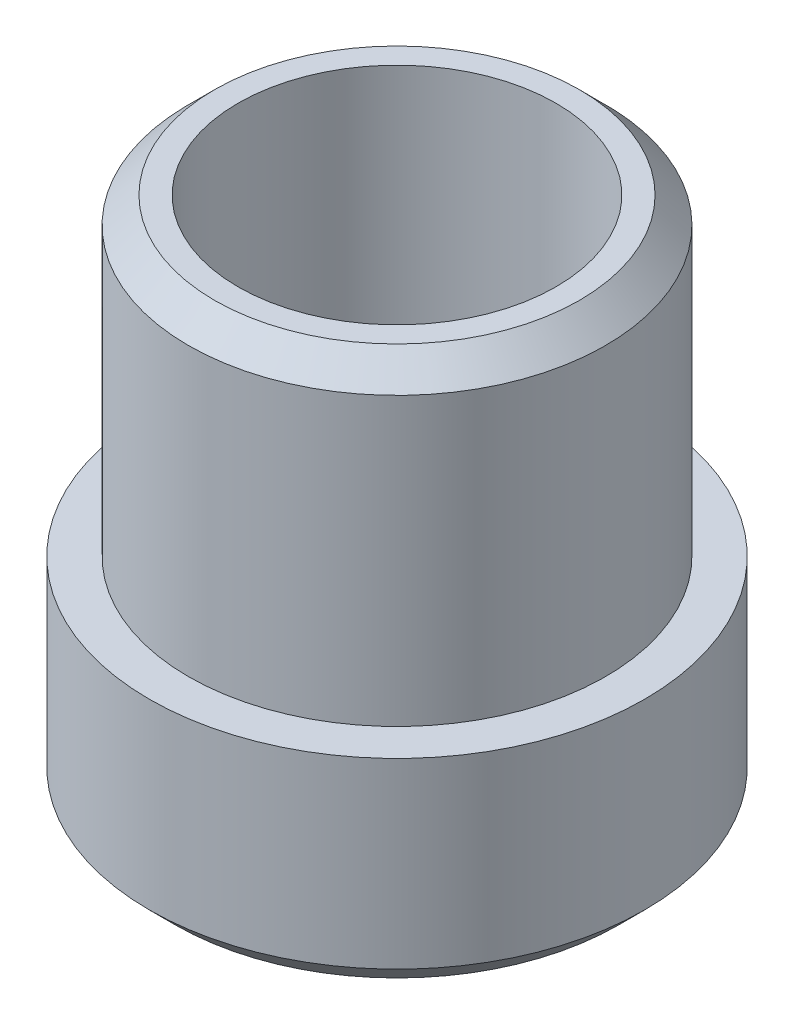
from build123d import *

# Parameters (mm, degrees)
SKETCH1_R           = 4.75
BOSS_EXTRUDE1_DEPTH = 4
SKETCH2_R           = 4
SKETCH2_R_2         = 3.05
BOSS_EXTRUDE2_DEPTH = 6
CHAMFER1_SIZE       = 0.5


with BuildPart() as part:
    # Sketch1 → Boss-Extrude1 (new body)
    with BuildSketch(Plane(origin=(0, 0, 0), x_dir=(1, 0, 0), z_dir=(0, 1, 0))):
        with Locations(Location((0, 0, 0), (0, 0, 270))):
            Circle(SKETCH1_R)
    extrude(amount=BOSS_EXTRUDE1_DEPTH)

    # Sketch2 → Boss-Extrude2 (add)
    with BuildSketch(Plane(origin=(0, 4, 0), x_dir=(1, 0, 0), z_dir=(0, 1, 0))):
        with Locations(Location((0, 0, 0), (0, 0, 270))):
            Circle(SKETCH2_R)
        with Locations(Location((0, 0, 0), (0, 0, 270))):
            Circle(SKETCH2_R_2, mode=Mode.SUBTRACT)
    extrude(amount=BOSS_EXTRUDE2_DEPTH)

    # Chamfer1
    chamfer1_edges = [part.edges().sort_by_distance(p)[0] for p in [
        (0, 0, -4.75),
        (0, 10, -4),
    ]]
    chamfer(chamfer1_edges, length=CHAMFER1_SIZE)


solid = part.part
